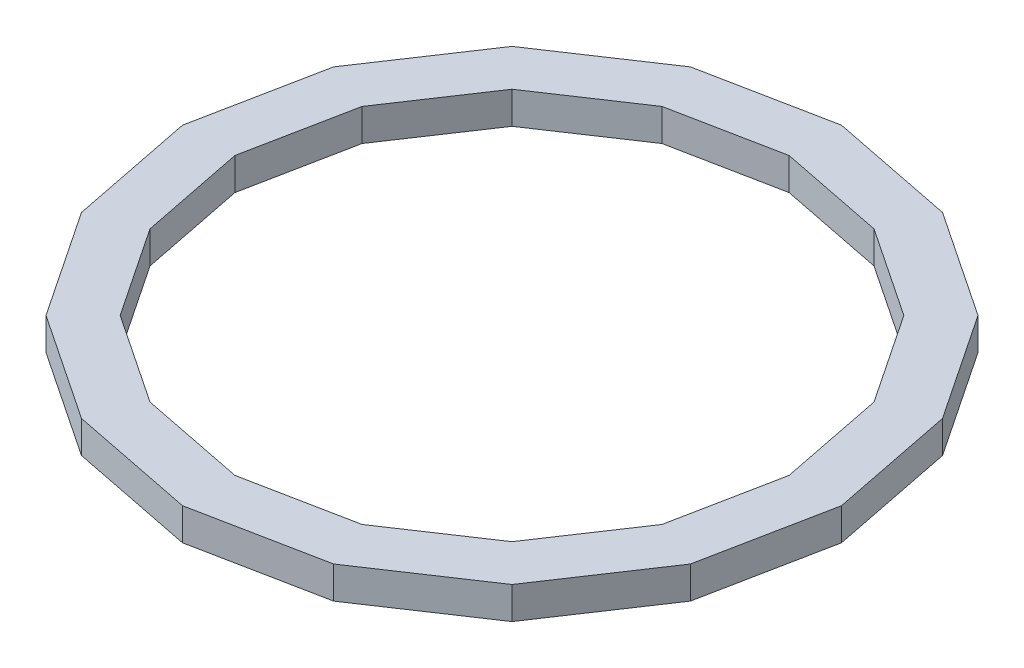
from build123d import *

# Parameters (mm, degrees)
BOSS_EXTRUDE1_DEPTH = 19.05


with BuildPart() as part:
    # Sketch1 → Boss-Extrude1 (new body)
    with BuildSketch(Plane(origin=(0, 0, 0), x_dir=(1, 0, 0), z_dir=(0, 1, 0))):
        Polygon((195.294157118, 0), (180.42827458, 74.735838367), (138.093822824, 138.093822824), (74.735838367, 180.42827458), (0, 195.294157118), (-74.735838367, 180.42827458), (-138.093822824, 138.093822824), (-180.42827458, 74.735838367), (-195.294157118, 0), (-180.42827458, -74.735838367), (-138.093822824, -138.093822824), (-74.735838367, -180.42827458), (0, -195.294157118), (74.735838367, -180.42827458), (138.093822824, -138.093822824), (180.42827458, -74.735838367), align=None)
        Polygon((164.217018616, 0), (151.716742389, 62.843132337), (116.118967449, 116.118967449), (62.843132337, 151.716742389), (0, 164.217018616), (-62.843132337, 151.716742389), (-116.118967449, 116.118967449), (-151.716742389, 62.843132337), (-164.217018616, 0), (-151.716742389, -62.843132337), (-116.118967449, -116.118967449), (-62.843132337, -151.716742389), (0, -164.217018616), (62.843132337, -151.716742389), (116.118967449, -116.118967449), (151.716742389, -62.843132337), align=None, mode=Mode.SUBTRACT)
    extrude(amount=BOSS_EXTRUDE1_DEPTH)


solid = part.part
